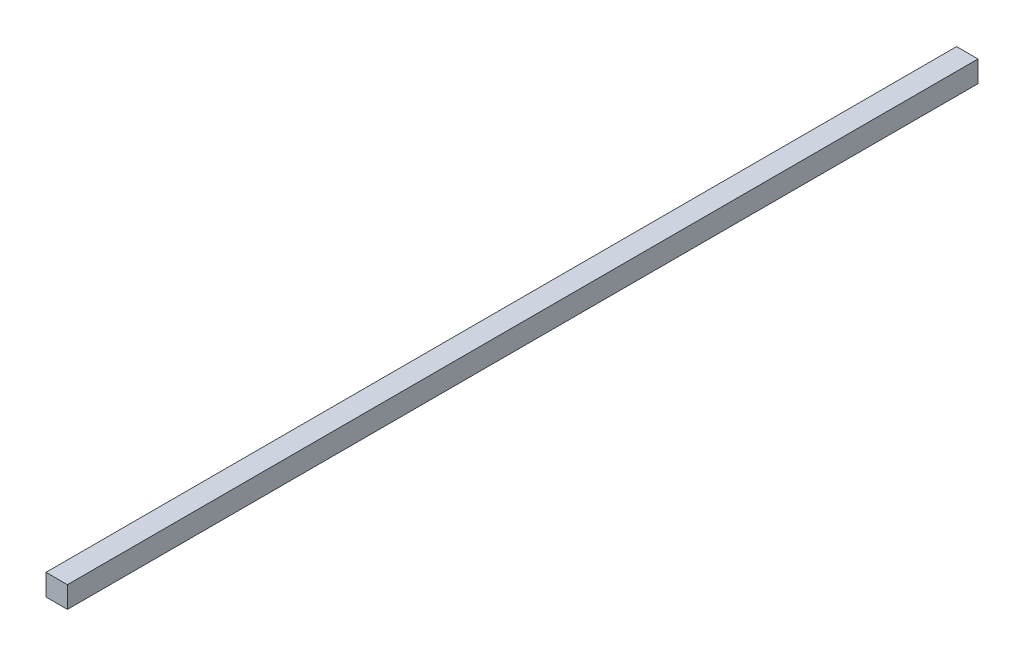
from build123d import *

# Parameters (mm, degrees)
SKETCH3_W           = 6
SKETCH3_H           = 6
BOSS_EXTRUDE1_DEPTH = 127.5


with BuildPart() as part:
    # Sketch3 → Boss-Extrude1 (new, symmetric)
    with BuildSketch(Plane.XY):
        Rectangle(SKETCH3_W, SKETCH3_H)
    extrude(amount=BOSS_EXTRUDE1_DEPTH, both=True)


solid = part.part
